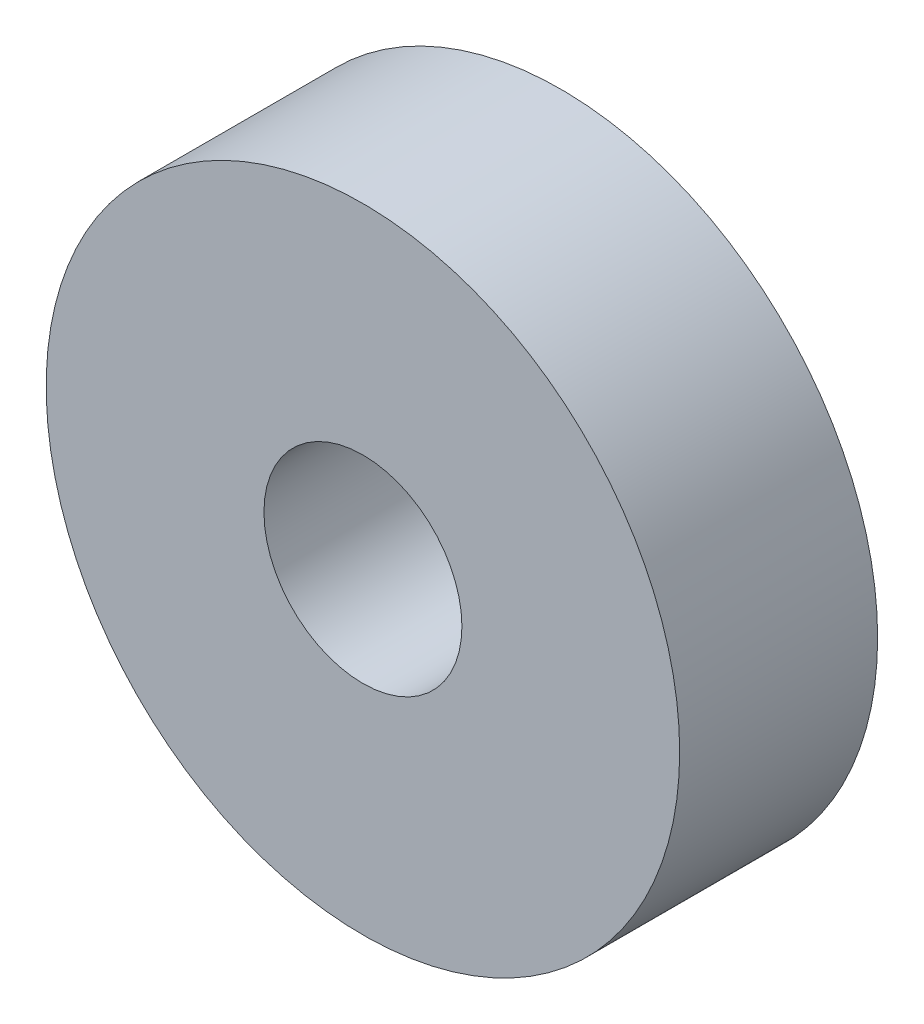
from build123d import *

# Parameters (mm, degrees)
SKETCH1_R           = 8
SKETCH1_R_2         = 2.5
BOSS_EXTRUDE1_DEPTH = 5


with BuildPart() as part:
    # Sketch1 → Boss-Extrude1 (new body)
    with BuildSketch(Plane.XY):
        Circle(SKETCH1_R)
        Circle(SKETCH1_R_2, mode=Mode.SUBTRACT)
    extrude(amount=BOSS_EXTRUDE1_DEPTH)


solid = part.part
